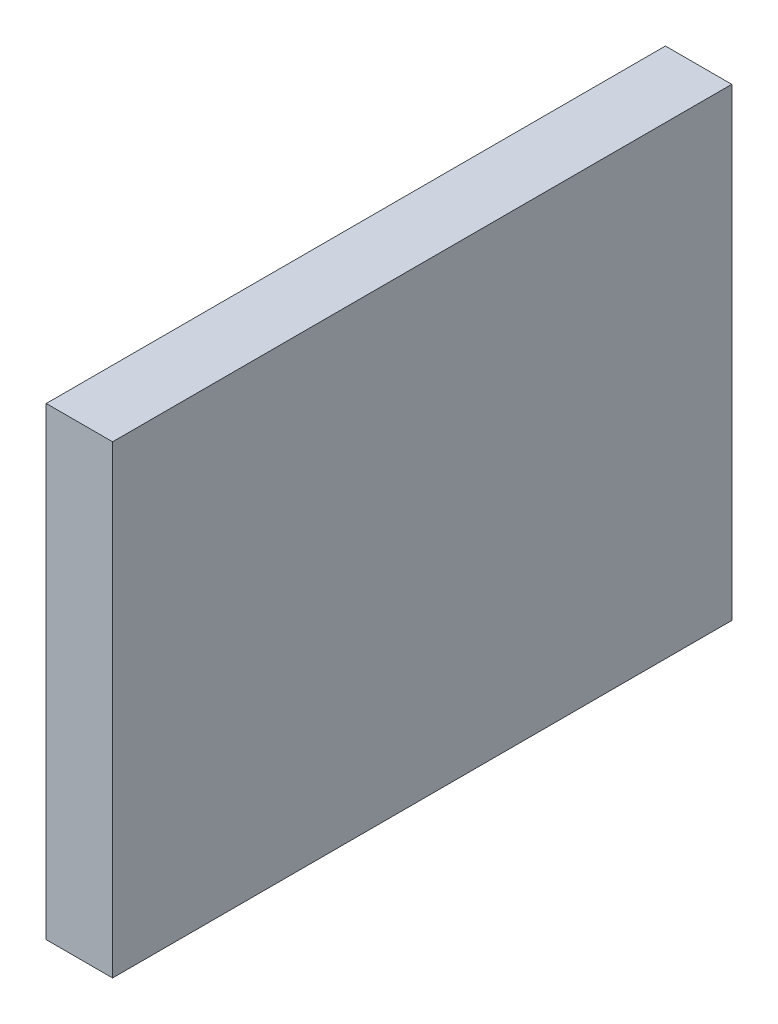
from build123d import *

# Parameters (mm, degrees)
SKETCH1_W           = 140
SKETCH1_H           = 105
BOSS_EXTRUDE1_DEPTH = 15


with BuildPart() as part:
    # Sketch1 → Boss-Extrude1 (new body)
    with BuildSketch(Plane(origin=(0, 0, 0), x_dir=(0, 0, -1), z_dir=(1, 0, 0))):
        with Locations((70, -52.5)):
            Rectangle(SKETCH1_W, SKETCH1_H)
    extrude(amount=BOSS_EXTRUDE1_DEPTH)


solid = part.part
